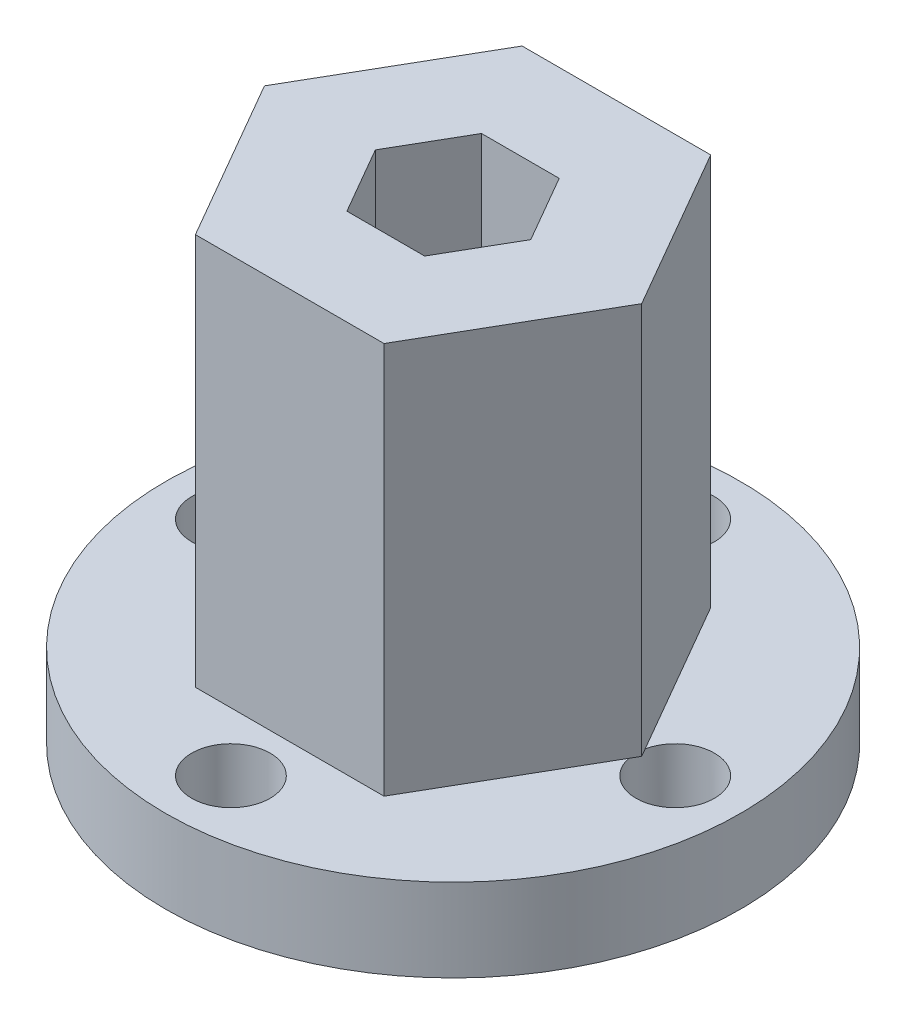
from build123d import *

# Parameters (mm, degrees)
SKETCH1_R           = 11
BOSS_EXTRUDE1_DEPTH = 3.175
BOSS_EXTRUDE2_DEPTH = 15
CUT_EXTRUDE2_DEPTH  = 28
SKETCH6_R           = 1.5
CUT_EXTRUDE3_DEPTH  = 8


with BuildPart() as part:
    # Sketch1 → Boss-Extrude1 (new body)
    with BuildSketch(Plane(origin=(0, 0, 0), x_dir=(1, 0, 0), z_dir=(0, 1, 0))):
        with Locations(Location((0, 0, 0), (0, 0, 270))):
            Circle(SKETCH1_R)
    extrude(amount=BOSS_EXTRUDE1_DEPTH)

    # Sketch2 → Boss-Extrude2 (add)
    with BuildSketch(Plane(origin=(0, 3.175, 0), x_dir=(1, 0, 0), z_dir=(0, 1, 0))):
        Polygon((3.608439182, -6.25), (7.216878365, 0), (3.608439182, 6.25), (-3.608439182, 6.25), (-7.216878365, 0), (-3.608439182, -6.25), align=None)
    extrude(amount=BOSS_EXTRUDE2_DEPTH)

    # Sketch3 → Cut-Extrude2 (cut)
    with BuildSketch(Plane(origin=(0, 18.175, 0), x_dir=(1, 0, 0), z_dir=(0, 1, 0))):
        Polygon((1.486676943, -2.575), (2.973353886, 0), (1.486676943, 2.575), (-1.486676943, 2.575), (-2.973353886, 0), (-1.486676943, -2.575), align=None)
    extrude(amount=-CUT_EXTRUDE2_DEPTH, mode=Mode.SUBTRACT)

    # Sketch6 → Cut-Extrude3 (cut)
    with BuildSketch(Plane(origin=(0, 3.175, 0), x_dir=(1, 0, 0), z_dir=(0, 1, 0))):
        with Locations(Location((0, 8.5, 0), (0, 0, 270))):
            Circle(SKETCH6_R)
        with Locations(Location((8.5, 0, 0), (0, 0, 270))):
            Circle(SKETCH6_R)
        with Locations(Location((0, -8.5, 0), (0, 0, 270))):
            Circle(SKETCH6_R)
        with Locations(Location((-8.5, 0, 0), (0, 0, 270))):
            Circle(SKETCH6_R)
    extrude(amount=-CUT_EXTRUDE3_DEPTH, mode=Mode.SUBTRACT)


solid = part.part
